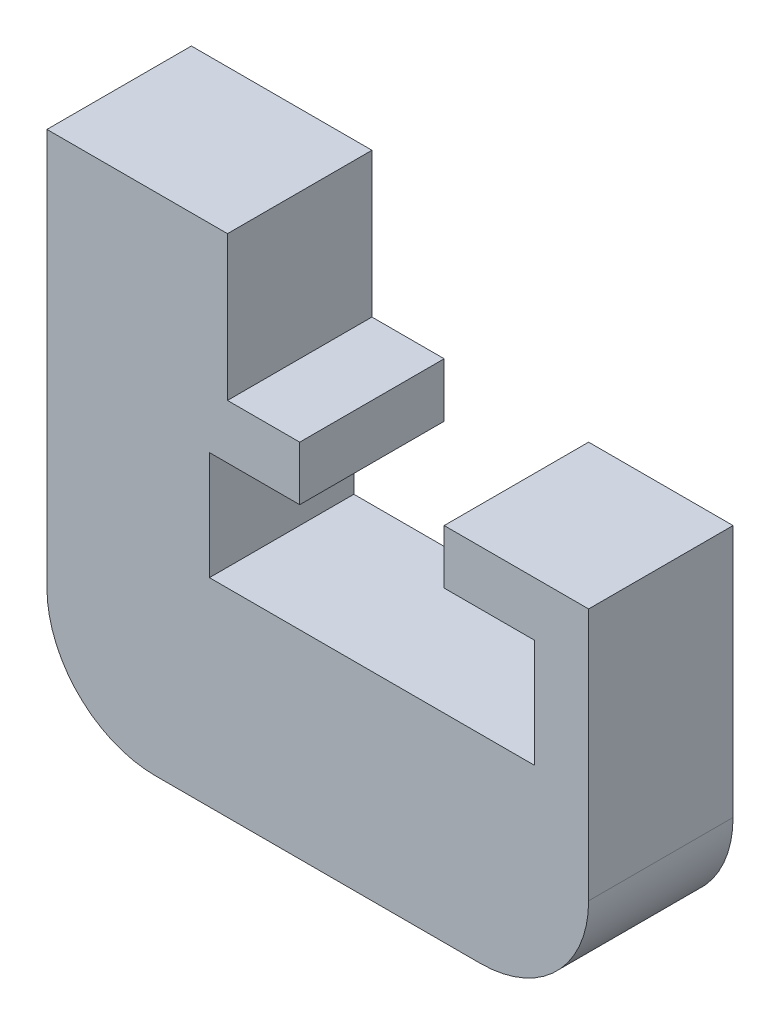
from build123d import *

# Parameters (mm, degrees)
SALIENTE_EXTRUIR1_DEPTH = 4


with BuildPart() as part:
    # Croquis1 → Saliente-Extruir1 (new body)
    with BuildSketch(Plane.XY):
        with BuildLine():
            Line((0, 23.001027223), (-5, 23.001027223))
            Line((-5, 23.001027223), (-5, 12.001027223))
            ThreePointArc((-5, 12.001027223), (-4.121320344, 9.87970688), (-2, 9.001027223))
            Line((-2, 9.001027223), (7, 9.001027223))
            ThreePointArc((7, 9.001027223), (9.121320344, 9.87970688), (10, 12.001027223))
            Line((10, 12.001027223), (10, 19.001027223))
            Line((10, 19.001027223), (6, 19.001027223))
            Line((6, 19.001027223), (6, 17.501027223))
            Line((6, 17.501027223), (8.5, 17.501027223))
            Line((8.5, 17.501027223), (8.5, 14.501027223))
            Line((8.5, 14.501027223), (-0.5, 14.501027223))
            Line((-0.5, 14.501027223), (-0.5, 17.501027223))
            Line((-0.5, 17.501027223), (2, 17.501027223))
            Line((2, 17.501027223), (2, 19.001027223))
            Line((2, 19.001027223), (0, 19.001027223))
            Line((0, 19.001027223), (0, 23.001027223))
        make_face()
    extrude(amount=SALIENTE_EXTRUIR1_DEPTH)


solid = part.part
